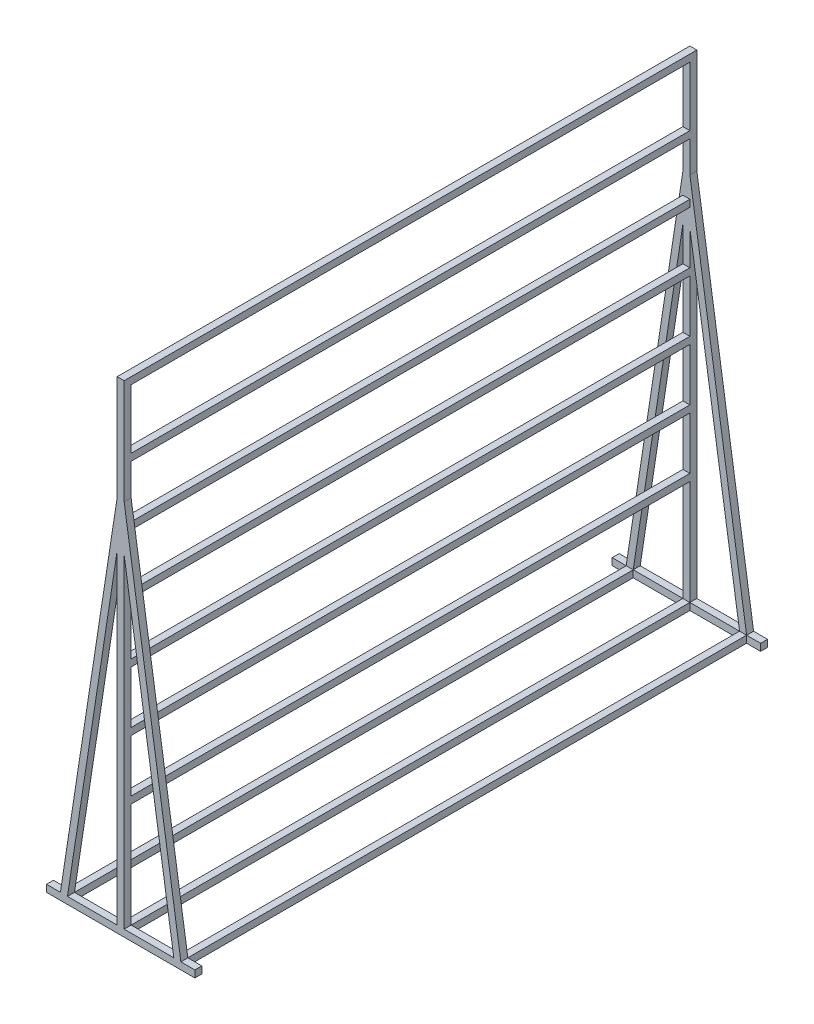
from build123d import *

# Parameters (mm, degrees)
CROQUIS1_W     = 40
CROQUIS1_H     = 40
EXTRUIR1_DEPTH = 425
CROQUIS2_W     = 40
CROQUIS2_H     = 40
EXTRUIR2_DEPTH = 1600
CROQUIS3_W     = 40
CROQUIS3_H     = 40
EXTRUIR3_DEPTH = 2720
EXTRUIR4_DEPTH = 40
CROQUIS5_W     = 40
CROQUIS5_H     = 40
EXTRUIR5_DEPTH = 3200
CROQUIS6_W     = 40
CROQUIS6_H     = 40
EXTRUIR6_DEPTH = 3200


with BuildPart() as part:
    # Croquis1 → Extruir1 (new, symmetric)
    with BuildSketch(Plane(origin=(0, 0, 0), x_dir=(0, 0, -1), z_dir=(1, 0, 0))):
        Rectangle(CROQUIS1_W, CROQUIS1_H)
    extrude(amount=EXTRUIR1_DEPTH, both=True)

    # Croquis2 → Extruir2 (add)
    with BuildSketch(Plane(origin=(0, 0, -20), x_dir=(-1, 0, 0), z_dir=(0, 0, -1))):
        Rectangle(CROQUIS2_W, CROQUIS2_H)
    extrude(amount=EXTRUIR2_DEPTH)

    # Simetría1: part across plane


with BuildPart() as part_1:
    add(part.part)
    add(part.part.mirror(Plane(origin=(-20, 20, -1620), x_dir=(1, 0, 0), z_dir=(0, 0, 1))))

    # Croquis3 → Extruir3 (add)
    with BuildSketch(Plane(origin=(0, 20, 0), x_dir=(1, 0, 0), z_dir=(0, 1, 0))):
        Rectangle(CROQUIS3_W, CROQUIS3_H)
        with Locations((0, 3240)):
            Rectangle(CROQUIS3_W, CROQUIS3_H)
    extrude(amount=EXTRUIR3_DEPTH)



with BuildPart() as body_2:
    # Croquis4 → Extruir4 (new body)
    with BuildSketch(Plane.XY.offset(20)):
        Polygon((345, 20), (20, 2140), (20, 1876.028690818), (304.532700243, 20), align=None)
    extrude(amount=-EXTRUIR4_DEPTH)


with BuildPart() as body_3:
    # Simetría2: mirrored copy
    add(body_2.part.mirror(Plane(origin=(0, 0, 0), x_dir=(0, 0, 1), z_dir=(1, 0, 0))))


with BuildPart() as body_4:
    # Simetría3: mirrored copy
    add(body_3.part.mirror(Plane(origin=(0, 0, -1620), x_dir=(1, 0, 0), z_dir=(0, 0, -1))))


with BuildPart() as body_5:
    # Simetr_a3 2: mirrored copy
    add(body_2.part.mirror(Plane(origin=(0, 0, -1620), x_dir=(1, 0, 0), z_dir=(0, 0, -1))))


with BuildPart() as part_2:
    add(part_1.part)

    add(body_2.part)  # Extruir5 merges body 2

    add(body_3.part)  # Extruir5 merges body 3

    add(body_4.part)  # Extruir5 merges body 4

    add(body_5.part)  # Extruir5 merges body 5
    # Croquis5 → Extruir5 (add)
    with BuildSketch(Plane(origin=(0, 0, -20), x_dir=(-1, 0, 0), z_dir=(0, 0, -1))):
        with Locations((0, 640)):
            Rectangle(CROQUIS5_W, CROQUIS5_H)
        with Locations((0, 980)):
            Rectangle(CROQUIS5_W, CROQUIS5_H)
        with Locations((0, 1320)):
            Rectangle(CROQUIS5_W, CROQUIS5_H)
        with Locations((0, 1660)):
            Rectangle(CROQUIS5_W, CROQUIS5_H)
        with Locations((0, 2000)):
            Rectangle(CROQUIS5_W, CROQUIS5_H)
        with Locations((0, 2340)):
            Rectangle(CROQUIS5_W, CROQUIS5_H)
        with Locations((0, 2720)):
            Rectangle(CROQUIS5_W, CROQUIS5_H)
    extrude(amount=EXTRUIR5_DEPTH)

    # Croquis6 → Extruir6 (add)
    with BuildSketch(Plane(origin=(0, 0, -20), x_dir=(-1, 0, 0), z_dir=(0, 0, -1))):
        with Locations((-324.532700243, 0)):
            Rectangle(CROQUIS6_W, CROQUIS6_H)
        with Locations((324.532700243, 0)):
            Rectangle(CROQUIS6_W, CROQUIS6_H)
    extrude(amount=EXTRUIR6_DEPTH)


solid = part_2.part
